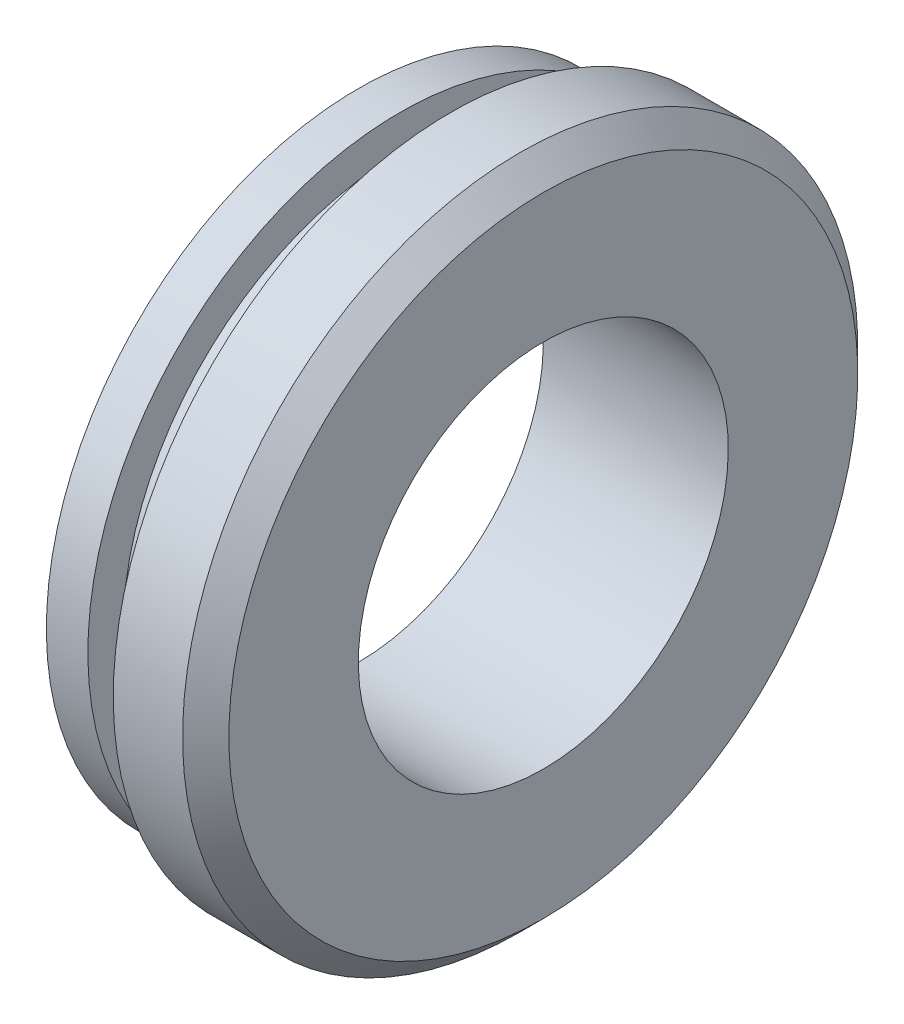
from build123d import *

# Parameters (mm, degrees)
CHAMFER_1_SIZE = 0.5


with BuildPart() as part:
    # Эскиз2 → Повернуть1 (revolve)
    with BuildSketch(Plane.XY, mode=Mode.PRIVATE) as revolve_1_sk:
        Polygon((14.5, 5.990991269), (14.5, 7.3), (16.5, 7.3), (16.5, 4), (12.5, 4), (12.5, 4.990991269), (12.5, 6.746286905), (13.39735467, 6.746286905), (13.39735467, 5.990991269), align=None)
    revolve(revolve_1_sk.sketch.rotate(Axis((0, 0, 0), (1, 0, 0)), 180), axis=Axis((0, 0, 0), (1, 0, 0)))

    # Фаска1
    chamfer_1_edges = [part.edges().sort_by_distance(p)[0] for p in [
        (16.5, 7.3, 0),
    ]]
    chamfer(chamfer_1_edges, length=CHAMFER_1_SIZE)


solid = part.part
